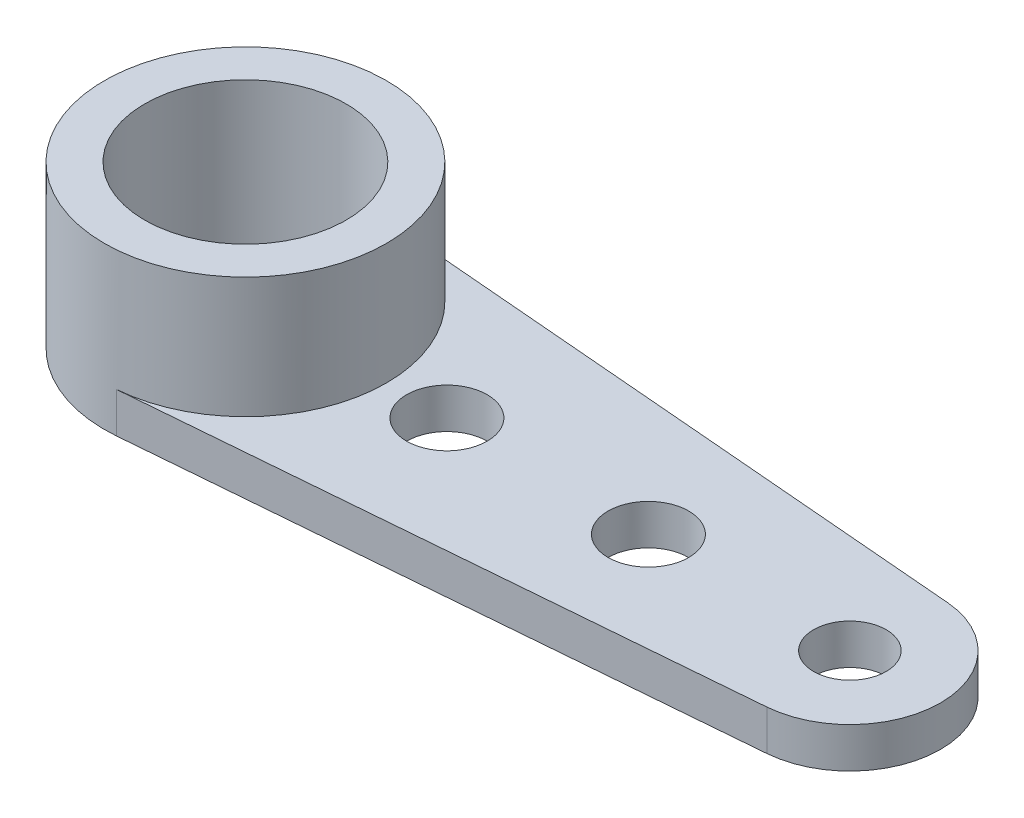
from build123d import *

# Parameters (mm, degrees)
BOSS_EXTRUDE1_DEPTH = 1
SKETCH2_R           = 3.5
BOSS_EXTRUDE2_DEPTH = 3
SKETCH3_R           = 2.5
CUT_EXTRUDE1_DEPTH  = 19.050277006
SKETCH4_R           = 0.9
CUT_EXTRUDE2_DEPTH  = 19.050277006
CUT_EXTRUDE3_DEPTH  = 19.050277006


with BuildPart() as part:
    # Sketch1 → Boss-Extrude1 (new body)
    with BuildSketch(Plane(origin=(0, 0, 0), x_dir=(1, 0, 0), z_dir=(0, 1, 0))):
        with BuildLine():
            Line((15.1875, 2.242173889), (0.291666667, 3.48782605))
            ThreePointArc((0.291666667, 3.48782605), (-3.5, 0), (0.291666667, -3.48782605))
            Line((0.291666667, -3.48782605), (15.1875, -2.242173889))
            ThreePointArc((15.1875, -2.242173889), (17.25, 0), (15.1875, 2.242173889))
        make_face()
    extrude(amount=BOSS_EXTRUDE1_DEPTH)

    # Sketch2 → Boss-Extrude2 (add)
    with BuildSketch(Plane(origin=(0, 1, 0), x_dir=(1, 0, 0), z_dir=(0, 1, 0))):
        with Locations(Location((0, 0, 0), (0, 0, 85.219808153))):
            Circle(SKETCH2_R)
    extrude(amount=BOSS_EXTRUDE2_DEPTH)

    # Sketch3 → Cut-Extrude1 (cut, through all)
    with BuildSketch(Plane(origin=(0, 4, 0), x_dir=(1, 0, 0), z_dir=(0, 1, 0))):
        with Locations(Location((0, 0, 0), (0, 0, 270))):
            Circle(SKETCH3_R)
    extrude(amount=-CUT_EXTRUDE1_DEPTH, mode=Mode.SUBTRACT)

    # Sketch4 → Cut-Extrude2 (cut, through all)
    with BuildSketch(Plane.XZ):
        with Locations(Location((15, 0, 0), (0, 0, 270))):
            Circle(SKETCH4_R)
    extrude(amount=-CUT_EXTRUDE2_DEPTH, mode=Mode.SUBTRACT)

    # Sketch5 → Cut-Extrude3 (cut, through all)
    with BuildSketch(Plane.XZ):
        with BuildLine():
            ThreePointArc((6, 0), (5, 1), (4, 0))
            Line((4, 0), (6, 0))
        make_face()
        with BuildLine():
            Line((6, 0), (4, 0))
            ThreePointArc((4, 0), (5, -1), (6, 0))
        make_face()
        with BuildLine():
            ThreePointArc((11, 0), (10, 1), (9, 0))
            Line((9, 0), (11, 0))
        make_face()
        with BuildLine():
            Line((11, 0), (9, 0))
            ThreePointArc((9, 0), (10, -1), (11, 0))
        make_face()
    extrude(amount=-CUT_EXTRUDE3_DEPTH, mode=Mode.SUBTRACT)


solid = part.part
